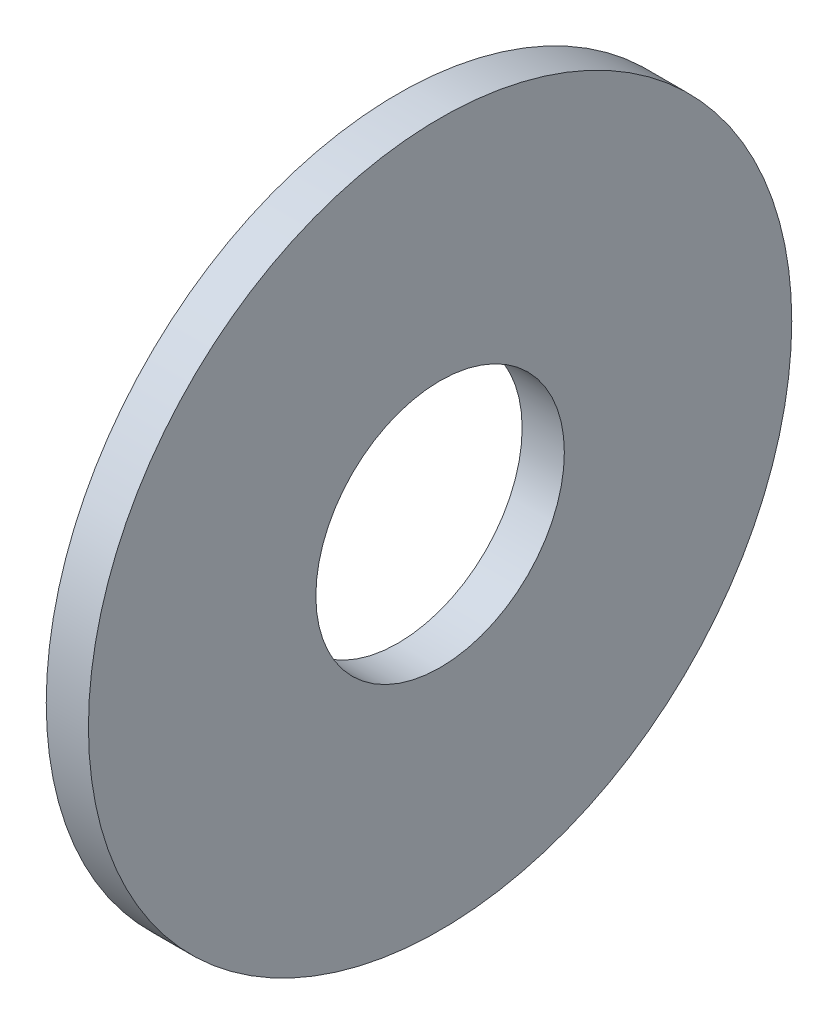
from build123d import *

# Parameters (mm, degrees)
SKETCH1_R           = 9.525
SKETCH1_R_2         = 3.3655
BOSS_EXTRUDE1_DEPTH = 1.143


with BuildPart() as part:
    # Sketch1 → Boss-Extrude1 (new body)
    with BuildSketch(Plane(origin=(0, 0, 0), x_dir=(0, 0, -1), z_dir=(1, 0, 0))):
        Circle(SKETCH1_R)
        Circle(SKETCH1_R_2, mode=Mode.SUBTRACT)
    extrude(amount=BOSS_EXTRUDE1_DEPTH)


solid = part.part
